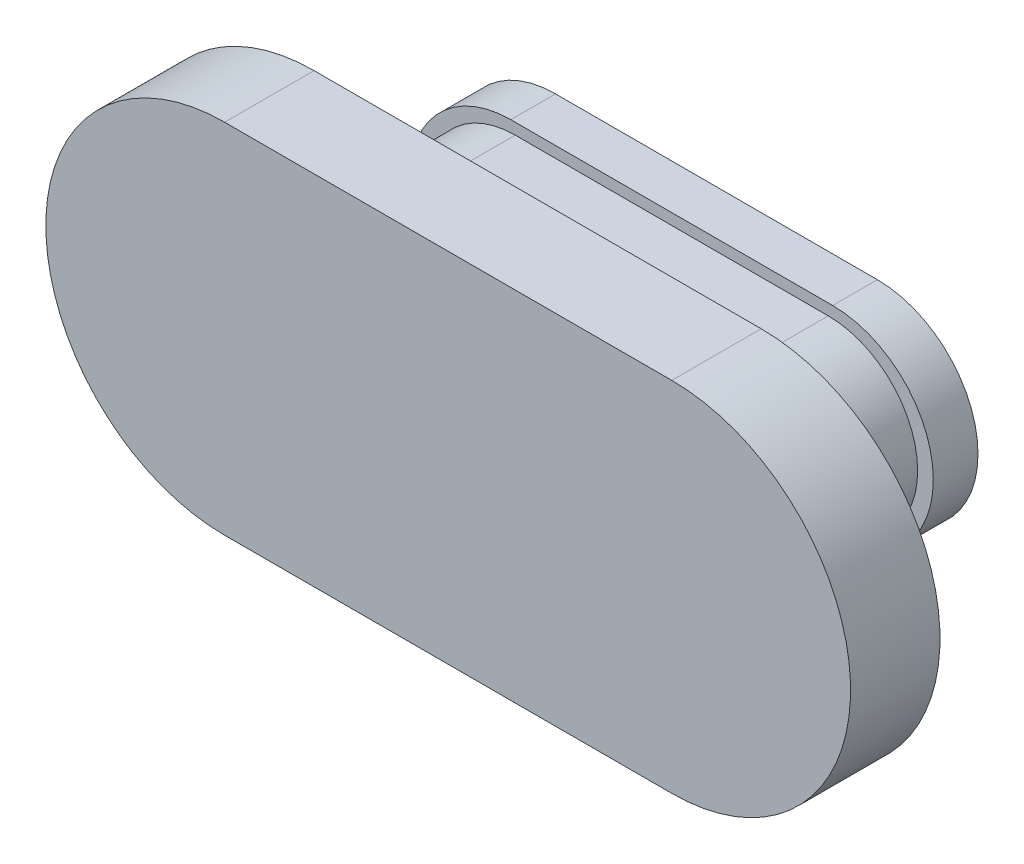
from build123d import *

# Parameters (mm, degrees)
BOSS_EXTRU_1_DEPTH = 1.5
BOSS_EXTRU_2_START = 1.5
BOSS_EXTRU_2_DEPTH = 2
BOSS_EXTRU_3_DEPTH = 1


with BuildPart() as part:
    # Esquisse1 → Boss.-Extru.1 (new, symmetric)
    with BuildSketch(Plane.XY):
        with BuildLine():
            Line((-3.5, 2), (3.5, 2))
            ThreePointArc((3.5, 2), (5.5, 0), (3.5, -2))
            Line((3.5, -2), (-3.5, -2))
            ThreePointArc((-3.5, -2), (-5.5, 0), (-3.5, 2))
        make_face()
    extrude(amount=BOSS_EXTRU_1_DEPTH, both=True)

    # Esquisse2 → Boss.-Extru.2 (add)
    with BuildSketch(Plane.XY.offset(BOSS_EXTRU_2_START)):
        with BuildLine():
            Line((-5, 4), (5, 4))
            ThreePointArc((5, 4), (9, 0), (5, -4))
            Line((5, -4), (-5, -4))
            ThreePointArc((-5, -4), (-9, 0), (-5, 4))
        make_face()
    extrude(amount=BOSS_EXTRU_2_DEPTH)

    # Esquisse3 → Boss.-Extru.3 (add)
    with BuildSketch(Plane(origin=(0, 0, -1.5), x_dir=(-1, 0, 0), z_dir=(0, 0, -1))):
        with BuildLine():
            Line((-3.6, 2.25), (3.6, 2.25))
            ThreePointArc((3.6, 2.25), (5.85, 0), (3.6, -2.25))
            Line((3.6, -2.25), (-3.6, -2.25))
            ThreePointArc((-3.6, -2.25), (-5.85, 0), (-3.6, 2.25))
        make_face()
    extrude(amount=BOSS_EXTRU_3_DEPTH)


solid = part.part
